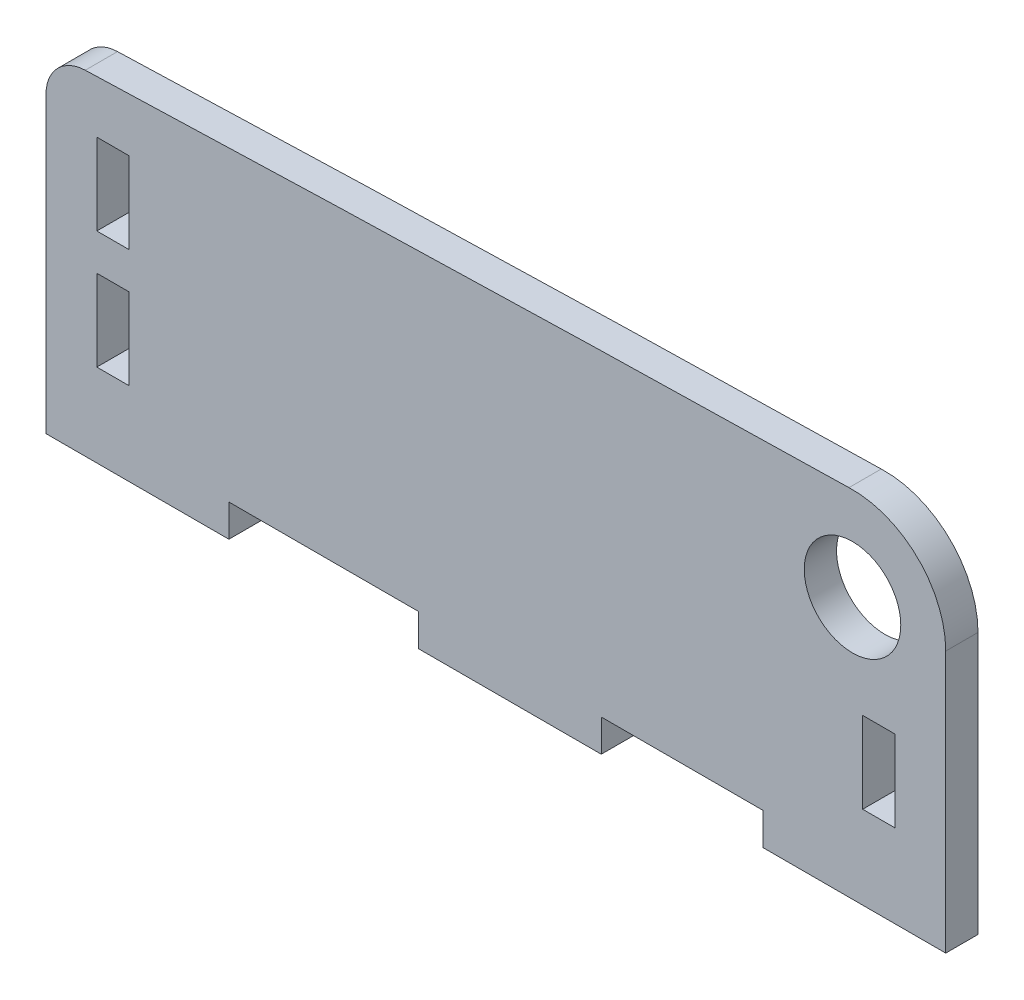
from build123d import *

# Parameters (mm, degrees)
SKETCH1_W            = 6.266
SKETCH1_H            = 19.6
SKETCH1_R            = 1.675
SKETCH1_W_2          = 52.832
SKETCH1_H_2          = 5
BOSS_EXTRUDE2_DEPTH  = 3.175
SKETCH3_W            = 30
SKETCH3_H            = 29.6
BOSS_EXTRUDE3_DEPTH  = 3.175
SKETCH4_R            = 4.75
CUT_EXTRUDE1_DEPTH   = 10
BOSS_EXTRUDE14_DEPTH = 3.175
CUT_EXTRUDE8_DEPTH   = 10
BOSS_EXTRUDE15_DEPTH = 3.175
BOSS_EXTRUDE16_DEPTH = 3.175
BOSS_EXTRUDE17_DEPTH = 3.175
FILLET5_R            = 4
SKETCH27_W           = 3.175
SKETCH27_H           = 8
CUT_EXTRUDE9_DEPTH   = 10
SKETCH28_W           = 18
SKETCH28_H           = 3.175
BOSS_EXTRUDE18_DEPTH = 3.175
SKETCH29_W           = 53.813797415
SKETCH29_H           = 23.475817665
BOSS_EXTRUDE19_DEPTH = 3.175


with BuildPart() as part:
    # Sketch1 → Boss-Extrude2 (new body)
    # profile 1 of 4: a face of its own
    with BuildSketch(Plane.XY):
        with Locations((-23.283, 0)):
            Rectangle(SKETCH1_W, SKETCH1_H)
        with Locations((-23.95, -4.974)):
            Circle(SKETCH1_R, mode=Mode.SUBTRACT)
        with Locations((-23.95, 4.974)):
            Circle(SKETCH1_R, mode=Mode.SUBTRACT)
    # profile 2 of 4: a face of its own
    with BuildSketch(Plane.XY):
        with Locations((23.283, 0)):
            Rectangle(SKETCH1_W, SKETCH1_H)
        with Locations((23.95, -4.974)):
            Circle(SKETCH1_R, mode=Mode.SUBTRACT)
        with Locations((23.95, 4.974)):
            Circle(SKETCH1_R, mode=Mode.SUBTRACT)
    # profile 3 of 4: a face of its own
    with BuildSketch(Plane.XY):
        with Locations((0, 12.3)):
            Rectangle(SKETCH1_W_2, SKETCH1_H_2)
    # profile 4 of 4: a face of its own
    with BuildSketch(Plane.XY):
        with Locations((0, -12.3)):
            Rectangle(SKETCH1_W_2, SKETCH1_H_2)
    extrude(amount=BOSS_EXTRUDE2_DEPTH)

    # Sketch3 → Boss-Extrude3 (add)
    with BuildSketch(Plane.XY.offset(3.175)):
        with Locations((41.416, 0)):
            Rectangle(SKETCH3_W, SKETCH3_H)
    extrude(amount=-BOSS_EXTRUDE3_DEPTH)

    # Sketch4 → Cut-Extrude1 (cut)
    with BuildSketch(Plane(origin=(0, 0, 0), x_dir=(-1, 0, 0), z_dir=(0, 0, -1))):
        with Locations((-40.576, 7.77)):
            Circle(SKETCH4_R)
    extrude(amount=-CUT_EXTRUDE1_DEPTH, mode=Mode.SUBTRACT)

    # Sketch22 → Boss-Extrude14 (add)
    with BuildSketch(Plane(origin=(0, 0, 0), x_dir=(-1, 0, 0), z_dir=(0, 0, -1))):
        with BuildLine():
            ThreePointArc((-34.680262133, 14.8), (-40.576, 16.945), (-46.471737867, 14.8))
            Line((-46.471737867, 14.8), (-34.680262133, 14.8))
        make_face()
    extrude(amount=-BOSS_EXTRUDE14_DEPTH)

    # Sketch23 → Cut-Extrude8 (cut)
    with BuildSketch(Plane(origin=(0, 0, 0), x_dir=(-1, 0, 0), z_dir=(0, 0, -1))):
        with BuildLine():
            Line((-49.751, -14.8), (-49.751, 7.77))
            ThreePointArc((-49.751, 7.77), (-48.890866804, 11.648609936), (-46.471737867, 14.8))
            Line((-46.471737867, 14.8), (-56.416, 14.8))
            Line((-56.416, 14.8), (-56.416, -14.8))
            Line((-56.416, -14.8), (-49.751, -14.8))
        make_face()
    extrude(amount=-CUT_EXTRUDE8_DEPTH, mode=Mode.SUBTRACT)

    # Sketch24 → Boss-Extrude15 (add)
    with BuildSketch(Plane(origin=(0, 0, 0), x_dir=(-1, 0, 0), z_dir=(0, 0, -1))):
        Polygon((30.625, 14.8), (26.416, 14.8), (26.416, -14.8), (27.751006616, -14.8), (30.625, -14.8), align=None)
    extrude(amount=-BOSS_EXTRUDE15_DEPTH)

    # Sketch25 → Boss-Extrude16 (add)
    with BuildSketch(Plane(origin=(0, 0, 0), x_dir=(-1, 0, 0), z_dir=(0, 0, -1))):
        Polygon((30.625, 14.8), (30.625, 9.8), (33.8, 9.8), (33.8, 1.8), (30.625, 1.8), (30.625, -1.8), (33.8, -1.8), (33.8, -9.8), (30.625, -9.8), (30.625, -14.8), (31.879074074, -14.8), (38.8, -14.8), (38.8, 14.8), align=None)
    extrude(amount=-BOSS_EXTRUDE16_DEPTH)

    # Sketch26 → Boss-Extrude17 (add)
    with BuildSketch(Plane(origin=(0, 0, 0), x_dir=(-1, 0, 0), z_dir=(0, 0, -1))):
        with BuildLine():
            ThreePointArc((-40.225848077, 16.938316019), (-37.275108655, 16.330650754), (-34.680262133, 14.8))
            Line((-34.680262133, 14.8), (38.8, 14.8))
            ThreePointArc((38.8, 14.8), (-0.708684686, 16.025831975), (-40.225848077, 16.938316019))
        make_face()
    extrude(amount=-BOSS_EXTRUDE17_DEPTH)

    # Fillet5
    fillet5_edges = [part.edges().sort_by_distance(p)[0] for p in [
        (-38.8, 14.8, 1.5875),
    ]]
    fillet(fillet5_edges, radius=FILLET5_R)

    # Sketch27 → Cut-Extrude9 (cut)
    with BuildSketch(Plane(origin=(0, 0, 0), x_dir=(-1, 0, 0), z_dir=(0, 0, -1))):
        with Locations((-43.1635, -5.8)):
            Rectangle(SKETCH27_W, SKETCH27_H)
    extrude(amount=-CUT_EXTRUDE9_DEPTH, mode=Mode.SUBTRACT)

    # Sketch28 → Boss-Extrude18 (add)
    with BuildSketch(Plane(origin=(0, 0, 0), x_dir=(-1, 0, 0), z_dir=(0, 0, -1))):
        with Locations((-40.751, -16.3875)):
            Rectangle(SKETCH28_W, SKETCH28_H)
        with Locations((-6.85, -16.3875)):
            Rectangle(SKETCH28_W, SKETCH28_H)
        with Locations((29.8, -16.3875)):
            Rectangle(SKETCH28_W, SKETCH28_H)
    extrude(amount=-BOSS_EXTRUDE18_DEPTH)

    # Sketch29 → Boss-Extrude19 (add)
    with BuildSketch(Plane(origin=(0, 0, 0), x_dir=(-1, 0, 0), z_dir=(0, 0, -1))):
        with Locations((0.393454416, 0.74908249)):
            Rectangle(SKETCH29_W, SKETCH29_H)
    extrude(amount=-BOSS_EXTRUDE19_DEPTH)


solid = part.part
